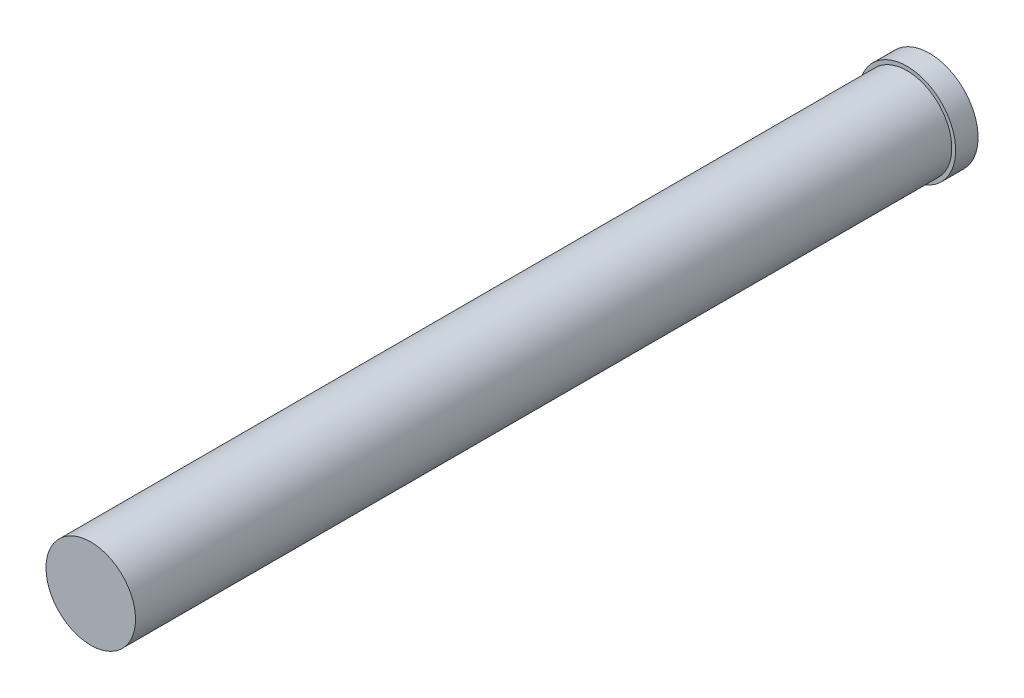
from build123d import *

# Parameters (mm, degrees)
SKETCH3_R           = 19
BOSS_EXTRUDE1_DEPTH = 356
SKETCH4_R           = 20.6375
BOSS_EXTRUDE2_DEPTH = 9.525
SKETCH5_R           = 15
CUT_EXTRUDE1_DEPTH  = 300


with BuildPart() as part:
    # Sketch3 → Boss-Extrude1 (new body)
    with BuildSketch(Plane.XY):
        Circle(SKETCH3_R)
    extrude(amount=BOSS_EXTRUDE1_DEPTH)

    # Sketch4 → Boss-Extrude2 (add)
    with BuildSketch(Plane(origin=(0, 0, 0), x_dir=(-1, 0, 0), z_dir=(0, 0, -1))):
        Circle(SKETCH4_R)
    extrude(amount=-BOSS_EXTRUDE2_DEPTH)

    # Sketch5 → Cut-Extrude1 (cut)
    with BuildSketch(Plane(origin=(0, 0, 0), x_dir=(-1, 0, 0), z_dir=(0, 0, -1))):
        Circle(SKETCH5_R)
    extrude(amount=-CUT_EXTRUDE1_DEPTH, mode=Mode.SUBTRACT)


solid = part.part
